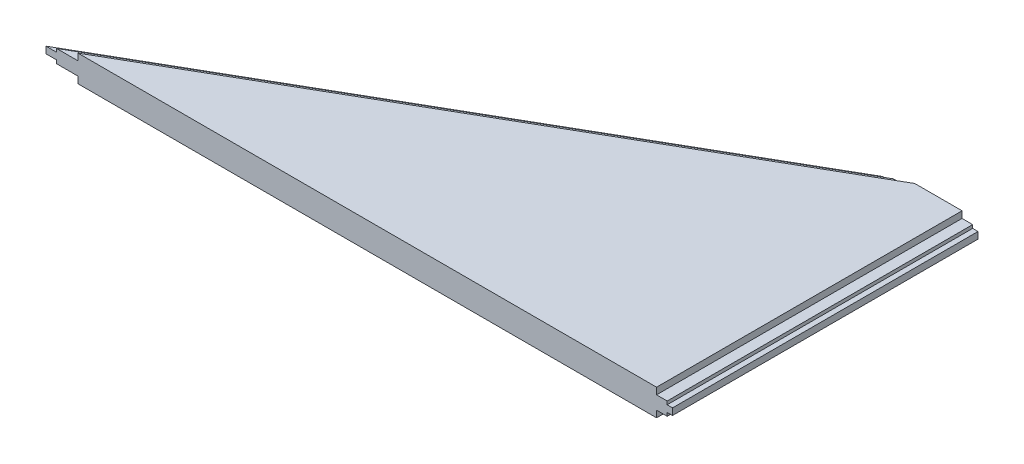
from build123d import *

# Parameters (mm, degrees)
BOSS_EXTRUDE1_DEPTH      = 6.35
BOSS_EXTRUDE1_DEPTH_BACK = 6.35
SKETCH2_W                = 292.995908675
SKETCH2_H                = 3.175
CUT_EXTRUDE1_DEPTH       = 38.1
SKETCH3_W                = 146.05
SKETCH3_H                = 3.175
CUT_EXTRUDE2_DEPTH       = 38.1
CUT_EXTRUDE3_DEPTH       = 3.175
CUT_EXTRUDE4_DEPTH       = 3.175
SKETCH6_W                = 5.08
SKETCH6_H                = 3.175
CUT_EXTRUDE5_DEPTH       = 157.099
CUT_EXTRUDE6_DEPTH       = 339.217
CUT_EXTRUDE6_DEPTH_BACK  = 157.099


with BuildPart() as part:
    # Sketch1 → Boss-Extrude1 (new, two sides: drawn at the far end of the back side and taken through both)
    with BuildSketch(Plane(origin=(0, 0, 0), x_dir=(1, 0, 0), z_dir=(0, 1, 0)).offset(-BOSS_EXTRUDE1_DEPTH_BACK)):
        Polygon((-406.4, 0), (0, 0), (0, 146.05), (-152.4, 146.05), align=None)
    extrude(amount=BOSS_EXTRUDE1_DEPTH + BOSS_EXTRUDE1_DEPTH_BACK)

    # Sketch2 → Cut-Extrude1 (cut)
    with BuildSketch(Plane(origin=(-100.979614843, 0, -175.616721465), x_dir=(-0.8669063030575352, 0, 0.49847112425808277), z_dir=(-0.4984711242580827, 0, -0.8669063030575351))):
        with Locations((205.812767226, 4.7625)):
            Rectangle(SKETCH2_W, SKETCH2_H)
        with Locations((205.812767226, -4.7625)):
            Rectangle(SKETCH2_W, SKETCH2_H)
    extrude(amount=-CUT_EXTRUDE1_DEPTH, mode=Mode.SUBTRACT)

    # Sketch3 → Cut-Extrude2 (cut)
    with BuildSketch(Plane(origin=(0, 0, 0), x_dir=(0, 0, -1), z_dir=(1, 0, 0))):
        with Locations((73.025, 4.7625)):
            Rectangle(SKETCH3_W, SKETCH3_H)
        with Locations((73.025, -4.7625)):
            Rectangle(SKETCH3_W, SKETCH3_H)
    extrude(amount=-CUT_EXTRUDE2_DEPTH, mode=Mode.SUBTRACT)

    # Sketch4 → Cut-Extrude3 (cut)
    with BuildSketch(Plane(origin=(0, 6.35, 0), x_dir=(1, 0, 0), z_dir=(0, 1, 0))):
        Polygon((-133.408250166, 113.020869854), (-75.966284694, 146.05), (-152.4, 146.05), align=None)
    extrude(amount=-CUT_EXTRUDE3_DEPTH, mode=Mode.SUBTRACT)

    # Sketch5 → Cut-Extrude4 (cut)
    with BuildSketch(Plane.XZ.offset(6.35)):
        Polygon((-133.408250166, -113.020869854), (-75.966284694, -146.05), (-152.4, -146.05), align=None)
    extrude(amount=-CUT_EXTRUDE4_DEPTH, mode=Mode.SUBTRACT)

    # Sketch6 → Cut-Extrude5 (cut)
    with BuildSketch(Plane(origin=(0, 0, -146.05), x_dir=(-1, 0, 0), z_dir=(0, 0, -1))):
        Polygon((0, -3.175), (38.1, -3.175), (38.1, -1.5875), (35.56, -1.5875), (35.56, 1.5875), (38.1, 1.5875), (38.1, 3.175), (0, 3.175), align=None)
        with Locations((40.64, -4.7625)):
            Rectangle(SKETCH6_W, SKETCH6_H)
        with Locations((40.64, 4.7625)):
            Rectangle(SKETCH6_W, SKETCH6_H)
    extrude(amount=-CUT_EXTRUDE5_DEPTH, mode=Mode.SUBTRACT)

    # Sketch8 → Cut-Extrude6 (cut, two sides: drawn at the far end of the back side and taken through both)
    with BuildSketch(Plane(origin=(-51.420385157, 0, 29.566721465), x_dir=(0.49847112425808243, 0, 0.8669063030575355), z_dir=(-0.8669063030575355, 0, 0.49847112425808243)).offset(-CUT_EXTRUDE6_DEPTH_BACK)):
        Polygon((-164.478664898, 1.5875), (-164.478664898, 3.175), (-159.398664898, 3.175), (-159.398664898, 6.35), (-164.478664898, 6.35), (-202.578664898, 6.35), (-202.578664898, -6.35), (-164.478664898, -6.35), (-159.398664898, -6.35), (-159.398664898, -3.175), (-164.478664898, -3.175), (-164.478664898, -1.5875), (-167.018664898, -1.5875), (-167.018664898, 1.5875), align=None)
    extrude(amount=CUT_EXTRUDE6_DEPTH + CUT_EXTRUDE6_DEPTH_BACK, mode=Mode.SUBTRACT)


solid = part.part
